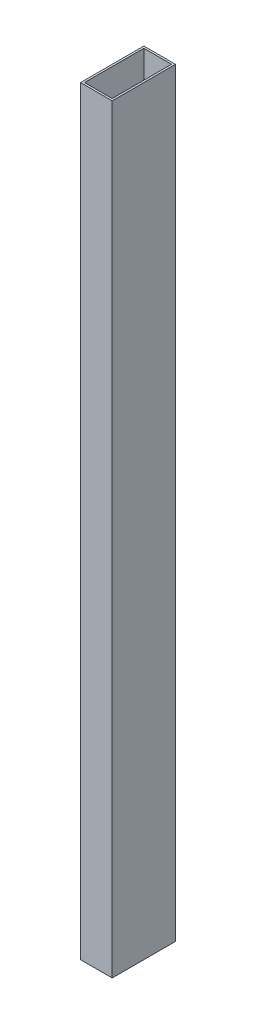
from build123d import *

# Parameters (mm, degrees)
SKETCH1_W           = 25.4
SKETCH1_H           = 50.8
SKETCH1_W_2         = 22.225
SKETCH1_H_2         = 47.625
BOSS_EXTRUDE1_DEPTH = 609.6


with BuildPart() as part:
    # Sketch1 → Boss-Extrude1 (new body)
    with BuildSketch(Plane(origin=(0, 0, 0), x_dir=(1, 0, 0), z_dir=(0, 1, 0))):
        Rectangle(SKETCH1_W, SKETCH1_H)
        Rectangle(SKETCH1_W_2, SKETCH1_H_2, mode=Mode.SUBTRACT)
    extrude(amount=BOSS_EXTRUDE1_DEPTH)


solid = part.part
